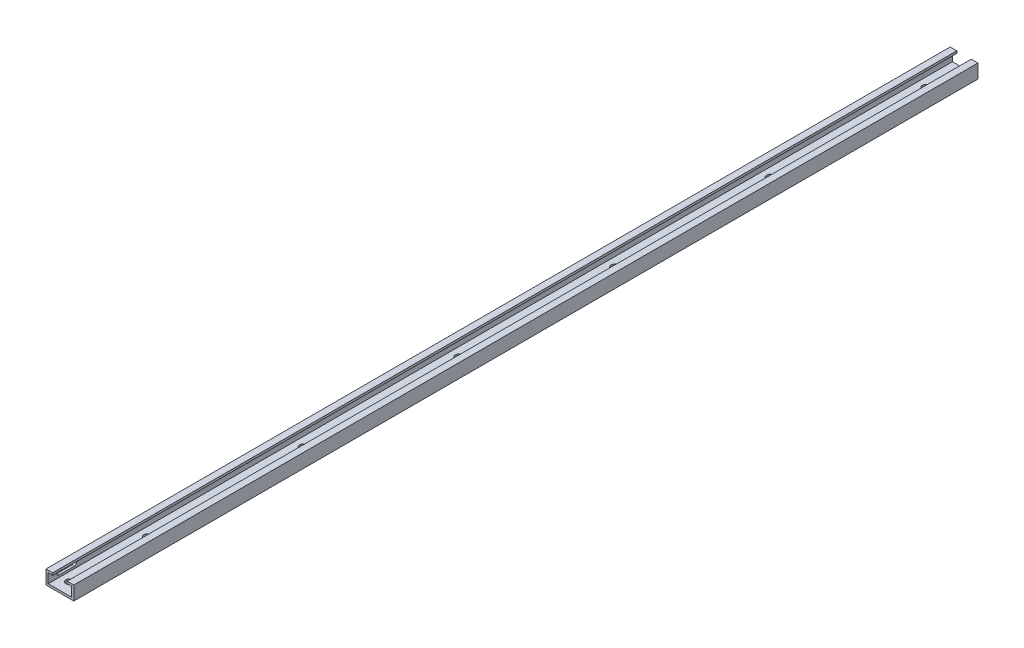
from build123d import *

# Parameters (mm, degrees)
BOSS_EXTRU_1_DEPTH         = 813
D_GAGEMENT_M61_D           = 6.6
R_P_TITION_LIN_AIRE1_COUNT = 12
R_P_TITION_LIN_AIRE1_PITCH = 70
CUT_EXTRUDE1_DEPTH         = 5


with BuildPart() as part:
    # Esquisse1 → Boss.-Extru.1 (new body)
    with BuildSketch(Plane.XY):
        Polygon((-6.5, 12.5), (-12.5, 12.5), (-12.5, 0), (12.5, 0), (12.5, 12.5), (6.5, 12.5), (6.5, 10.5), (10.5, 10.5), (10.5, 2), (-10.5, 2), (-10.5, 10.5), (-6.5, 10.5), align=None)
    extrude(amount=BOSS_EXTRU_1_DEPTH)

    # Dégagement M61 (through all)
    with Locations(Plane(origin=(0, 0, 0), x_dir=(-1, 0, 0), z_dir=(0, -1, 0))):
        with Locations((2.40627347, -801.806864395)):
            d_gagement_m61 = Hole(D_GAGEMENT_M61_D / 2)

    # Répétition linéaire1: Dégagement M61 ×12, 5 skipped
    with Locations(*[(0, 0, -i * R_P_TITION_LIN_AIRE1_PITCH) for i in range(1, R_P_TITION_LIN_AIRE1_COUNT) if i not in (2, 4, 6, 8, 10)]):
        add(d_gagement_m61, mode=Mode.SUBTRACT)

    # Sketch1 → Cut-Extrude1 (cut)
    with BuildSketch(Plane(origin=(-12.5, 0, 0), x_dir=(0, 0, -1), z_dir=(1, 0, 0))):
        with BuildLine():
            Line((-803, 8.949119862), (-789.837109693, 8.949119862))
            ThreePointArc((-789.837109693, 8.949119862), (-787.337109693, 6.449119862), (-789.837109693, 3.949119862))
            Line((-789.837109693, 3.949119862), (-803, 3.949119862))
            ThreePointArc((-803, 3.949119862), (-805.5, 6.449119862), (-803, 8.949119862))
        make_face()
    extrude(amount=CUT_EXTRUDE1_DEPTH, mode=Mode.SUBTRACT)


solid = part.part
